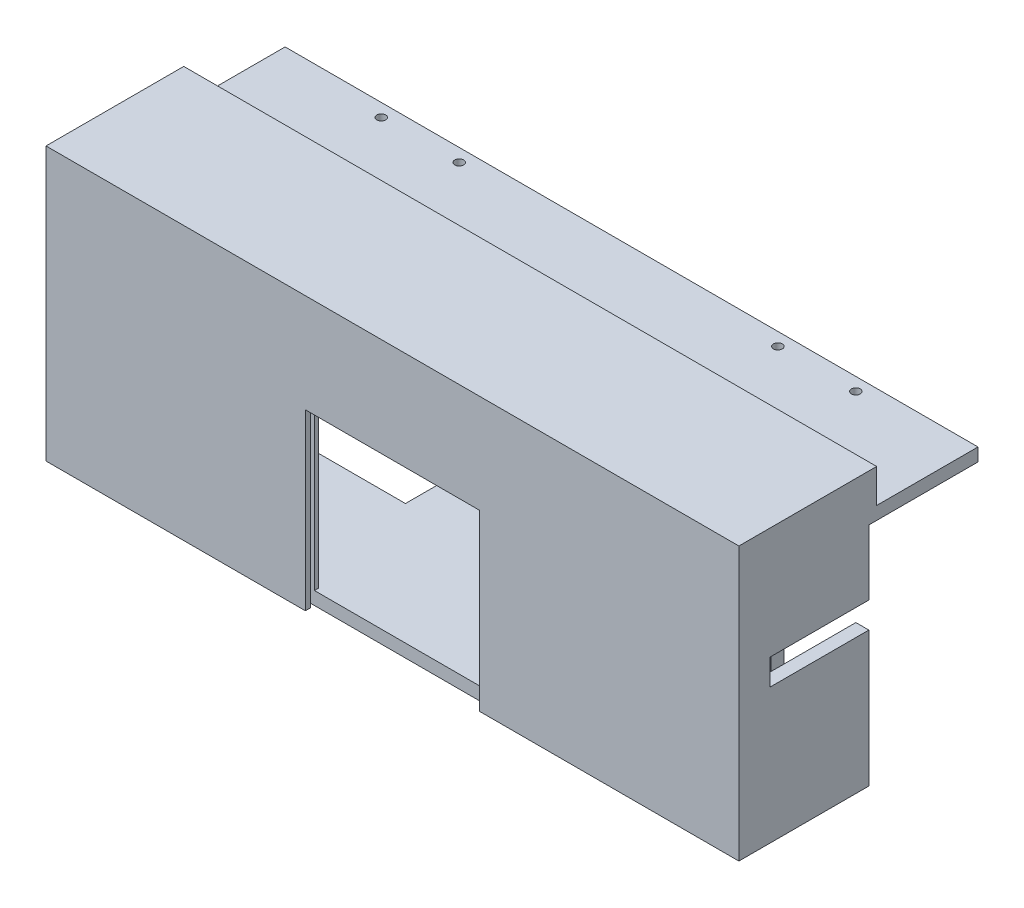
from build123d import *

# Parameters (mm, degrees)
SKETCH1_W                     = 5
SKETCH1_H                     = 47.5
SKETCH1_W_2                   = 67
SKETCH1_H_2                   = 5
SKETCH1_H_3                   = 34.5
SKETCH1_H_4                   = 8
WALLS_DEPTH                   = 50
ROOF_START                    = 50
SKETCH1_3_W                   = 266.6000032
SKETCH1_3_H                   = 105
SKETCH1_3_W_2                 = 67
SKETCH1_3_H_2                 = 67
ROOF_DEPTH                    = 5
SKETCH1_4_W                   = 256.6000032
SKETCH1_4_H                   = 5
SKETCH1_4_W_2                 = 5
SPACER_DEPTH                  = 42
FIBER_CUTOUT_DEPTH            = 291.861757036
FIBER_CUTOUT_DEPTH_BACK       = 291.861757036
SKETCH2_W                     = 38
SKETCH2_H                     = 10
M3_CLEARANCE_HOLE_D           = 3.4
SKETCH1_6_W                   = 5
SKETCH1_6_H                   = 8
SKETCH1_6_W_2                 = 256.6000032
REAR_WALL_FLOOR_DEPTH         = 3
WINDOW_THROUGH_CUT_DEPTH      = 291.861757036
WINDOW_THROUGH_CUT_DEPTH_BACK = 70
SKETCH6_W                     = 70
SKETCH6_H                     = 1.5
WINDOW_START                  = 50
SKETCH1_8_W                   = 67
SKETCH1_8_H                   = 47.5
SKETCH1_8_H_2                 = 14.5
WINDOW_SLOT_CUT_DEPTH         = 5
SKETCH1_9_W                   = 67
SKETCH1_9_H                   = 5
WINDOW_EDGE_THROUGH_CUT_DEPTH = 3.5
FRONT_LEG_MOUNTING_DEPTH      = 45
FRONT_LEG_MOUNTING_DEPTH_BACK = 45
F_1_4_CLEARANCE_HOLE1_D       = 6.7564
FRONT_HOLE_CUTOUT_REACH       = 292.129


with BuildPart() as part:
    # Sketch1 → Walls (new body)
    with BuildSketch(Plane(origin=(0, 0, 0), x_dir=(-1, 0, 0), z_dir=(0, 0, 1))):
        Polygon((0, 105), (0, 100), (5, 100), (99.8000016, 100), (99.8000016, 105), align=None)
        Polygon((166.8000016, 100), (261.6000032, 100), (266.6000032, 100), (266.6000032, 105), (166.8000016, 105), align=None)
        with Locations((264.1000032, 76.25)):
            Rectangle(SKETCH1_W, SKETCH1_H)
        with Locations((133.3000016, 102.5)):
            Rectangle(SKETCH1_W_2, SKETCH1_H_2)
        with Locations((264.1000032, 35.25)):
            Rectangle(SKETCH1_W, SKETCH1_H_3)
        with Locations((264.1000032, 15.5)):
            Rectangle(SKETCH1_W, SKETCH1_H_2)
        with Locations((264.1000032, 9)):
            Rectangle(SKETCH1_W, SKETCH1_H_4)
        Polygon((5, 5), (0, 5), (0, 0), (266.6000032, 0), (266.6000032, 5), (261.6000032, 5), align=None)
        with Locations((2.5, 9)):
            Rectangle(SKETCH1_W, SKETCH1_H_4)
        with Locations((2.5, 15.5)):
            Rectangle(SKETCH1_W, SKETCH1_H_2)
        with Locations((2.5, 35.25)):
            Rectangle(SKETCH1_W, SKETCH1_H_3)
        with Locations((2.5, 76.25)):
            Rectangle(SKETCH1_W, SKETCH1_H)
    extrude(amount=WALLS_DEPTH)

    # Sketch1<3> → roof (add)
    with BuildSketch(Plane(origin=(0, 0, 0), x_dir=(-1, 0, 0), z_dir=(0, 0, 1)).offset(ROOF_START)):
        with Locations((133.3000016, 52.5)):
            Rectangle(SKETCH1_3_W, SKETCH1_3_H)
        with Locations((133.3000016, 71.5)):
            Rectangle(SKETCH1_3_W_2, SKETCH1_3_H_2)
    extrude(amount=-ROOF_DEPTH)

    # Sketch1<4> → spacer (add)
    with BuildSketch(Plane(origin=(0, 0, 0), x_dir=(-1, 0, 0), z_dir=(0, 0, 1))):
        with Locations((133.3000016, 15.5)):
            Rectangle(SKETCH1_4_W, SKETCH1_4_H)
        with Locations((2.5, 15.5)):
            Rectangle(SKETCH1_4_W_2, SKETCH1_4_H)
        with Locations((264.1000032, 15.5)):
            Rectangle(SKETCH1_4_W_2, SKETCH1_4_H)
    extrude(amount=-SPACER_DEPTH)

    # Sketch2 → fiber cutout (cut, two sides: drawn at the far end of the back side and taken through both)
    with BuildSketch(Plane.ZY.offset(266.6000032).offset(-FIBER_CUTOUT_DEPTH_BACK)):
        with Locations((19, -48.0141)):
            Rectangle(SKETCH2_W, SKETCH2_H)
    extrude(amount=FIBER_CUTOUT_DEPTH + FIBER_CUTOUT_DEPTH_BACK, mode=Mode.SUBTRACT)

    # M3 Clearance Hole (through all)
    with Locations(Plane.XZ.offset(18)):
        with Locations((-224.6, -9), (-42, -9), (-72, -9), (-72, -37), (-42, -37), (-224.6, -37), (-194.6, -37), (-194.6, -9)):
            Hole(M3_CLEARANCE_HOLE_D / 2)

    # Sketch1<6> → rear wall floor (add)
    with BuildSketch(Plane(origin=(0, 0, 0), x_dir=(-1, 0, 0), z_dir=(0, 0, 1))):
        Polygon((5, 5), (0, 5), (0, 0), (266.6000032, 0), (266.6000032, 5), (261.6000032, 5), align=None)
        with Locations((2.5, 9)):
            Rectangle(SKETCH1_6_W, SKETCH1_6_H)
        with Locations((133.3000016, 9)):
            Rectangle(SKETCH1_6_W_2, SKETCH1_6_H)
        with Locations((264.1000032, 9)):
            Rectangle(SKETCH1_6_W, SKETCH1_6_H)
    extrude(amount=-REAR_WALL_FLOOR_DEPTH)

    # Sketch6 → window through cut (cut, two sides: drawn at the far end of the back side and taken through both)
    with BuildSketch(Plane.XZ.offset(105).offset(-WINDOW_THROUGH_CUT_DEPTH_BACK)):
        with Locations((-133.3000016, 47.25)):
            Rectangle(SKETCH6_W, SKETCH6_H)
    extrude(amount=WINDOW_THROUGH_CUT_DEPTH + WINDOW_THROUGH_CUT_DEPTH_BACK, mode=Mode.SUBTRACT)

    # Sketch1<8> → window slot cut (cut)
    with BuildSketch(Plane(origin=(0, 0, 0), x_dir=(-1, 0, 0), z_dir=(0, 0, 1)).offset(WINDOW_START)):
        with Locations((133.3000016, 76.25)):
            Rectangle(SKETCH1_8_W, SKETCH1_8_H)
        with Locations((133.3000016, 45.25)):
            Rectangle(SKETCH1_8_W, SKETCH1_8_H_2)
    extrude(amount=-WINDOW_SLOT_CUT_DEPTH, mode=Mode.SUBTRACT)

    # Sketch1<9> → window edge through cut (cut)
    with BuildSketch(Plane(origin=(0, 0, 0), x_dir=(-1, 0, 0), z_dir=(0, 0, 1)).offset(WINDOW_START)):
        with Locations((133.3000016, 102.5)):
            Rectangle(SKETCH1_9_W, SKETCH1_9_H)
    extrude(amount=-WINDOW_EDGE_THROUGH_CUT_DEPTH, mode=Mode.SUBTRACT)

    # Sketch7 → Front leg mounting (add, two sides: drawn at the far end of the back side and taken through both)
    with BuildSketch(Plane(origin=(-133.3000016, 0, 50), x_dir=(0, 0, -1), z_dir=(1, 0, 0)).offset(-FRONT_LEG_MOUNTING_DEPTH_BACK)):
        Polygon((105.668753763, -120), (105.668753763, -143.441918177), (100.668753763, -143.441918177), (100.668753763, -123.441918177), (50, -105), (50, -100), (75.668753763, -100), align=None)
    extrude(amount=FRONT_LEG_MOUNTING_DEPTH + FRONT_LEG_MOUNTING_DEPTH_BACK)

    # 1/4 Clearance Hole1 (through all)
    with Locations(Plane.XY.offset(-50.668753763)):
        with Locations((-95.2000016, -136.4), (-171.4000016, -136.4)):
            Hole(F_1_4_CLEARANCE_HOLE1_D / 2)

    # Front hole cutout: up to this face of the body (flat: up to its plane)
    front_hole_cutout_end = Plane(part.part.faces().sort_by_distance((-133.3000016, -143.441918177, -53.168753763))[0])
    # Sketch11 → Front hole cutout (cut, up to the picked face)
    with BuildSketch(Plane(origin=(0, -100, 0), x_dir=(1, 0, 0), z_dir=(0, 1, 0)), mode=Mode.PRIVATE) as front_hole_cutout_sk1:
        Polygon((-146.3000016, 55.668753763), (-146.3000016, 29.5285), (-145.6194242, 25.668753763), (-120.980579, 25.668753763), (-120.3000016, 29.5285), (-120.3000016, 55.668753763), align=None)
    front_hole_cutout_tool1 = split(extrude(front_hole_cutout_sk1.sketch, amount=-FRONT_HOLE_CUTOUT_REACH, mode=Mode.PRIVATE), bisect_by=front_hole_cutout_end, keep=Keep.BOTH, mode=Mode.PRIVATE)
    # Sketch11 → Front hole cutout (cut, up to the picked face)
    with BuildSketch(Plane(origin=(0, -100, 0), x_dir=(1, 0, 0), z_dir=(0, 1, 0)), mode=Mode.PRIVATE) as front_hole_cutout_sk2:
        Polygon((-120.980579, 25.668753763), (-145.6194242, 25.668753763), (-145.065712735, 22.5285), (-121.534290465, 22.5285), align=None)
    front_hole_cutout_tool2 = split(extrude(front_hole_cutout_sk2.sketch, amount=-FRONT_HOLE_CUTOUT_REACH, mode=Mode.PRIVATE), bisect_by=front_hole_cutout_end, keep=Keep.BOTH, mode=Mode.PRIVATE)
    add(front_hole_cutout_tool1.solids().sort_by(Axis((-133.300002, -100, -40.715093), (0, -1, 0)))[0], mode=Mode.SUBTRACT)
    add(front_hole_cutout_tool2.solids().sort_by(Axis((-133.300002, -100, -24.110659), (0, -1, 0)))[0], mode=Mode.SUBTRACT)


solid = part.part
